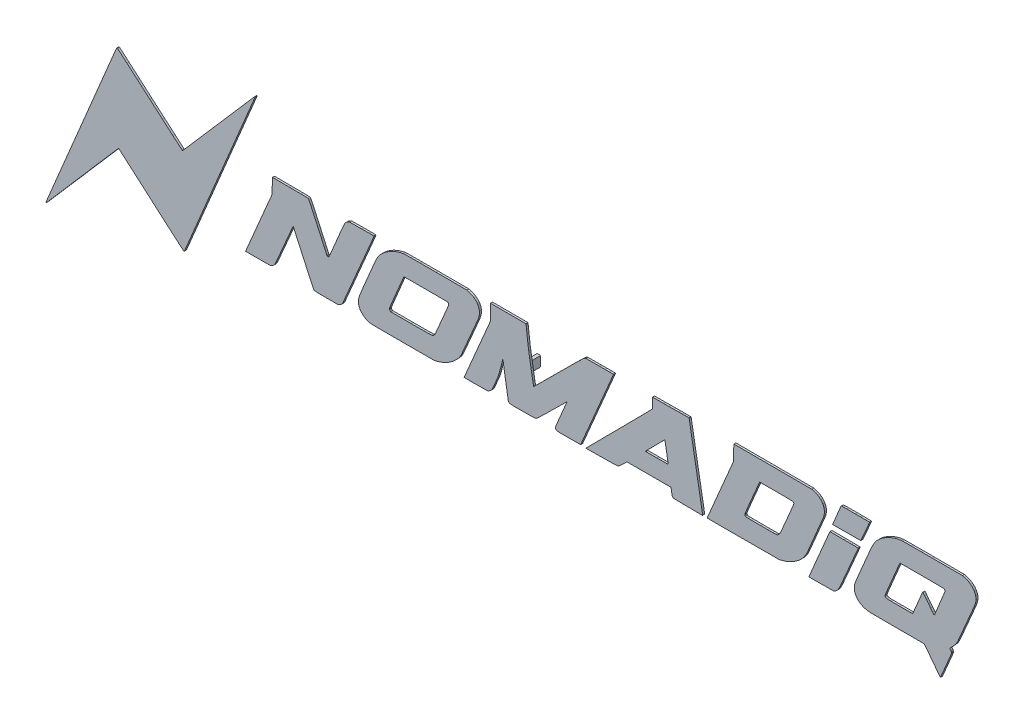
from build123d import *

# Parameters (mm, degrees)
Y_KSEKLIK_EKSTR_ZYON1_DEPTH   = 0.2
Y_KSEKLIK_EKSTR_ZYON1_2_DEPTH = 0.2
Y_KSEKLIK_EKSTR_ZYON1_3_DEPTH = 0.2
Y_KSEKLIK_EKSTR_ZYON1_4_DEPTH = 0.2
Y_KSEKLIK_EKSTR_ZYON1_5_DEPTH = 0.2
Y_KSEKLIK_EKSTR_ZYON1_6_DEPTH = 0.2
Y_KSEKLIK_EKSTR_ZYON1_7_DEPTH = 0.2
Y_KSEKLIK_EKSTR_ZYON1_8_DEPTH = 0.2
Y_KSEKLIK_EKSTR_ZYON1_9_DEPTH = 0.2
SKETCH4_W                     = 0.347706158
SKETCH4_H                     = 0.98459693
BOSS_EXTRUDE2_DEPTH           = 1
SCALE1_SCALE                  = 1.1


with BuildPart() as part:
    # Çizim1 → Yükseklik-Ekstrüzyon1 (new body)
    with BuildSketch(Plane.XY):
        with BuildLine():
            Line((-30.51702252, 5.640207004), (-31.881612062, 4.06777004))
            Line((-31.881612062, 4.06777004), (-33.036250842, 2.743929182))
            Line((-33.036250842, 2.743929182), (-34.080710724, 1.55031139))
            ThreePointArc((-34.080710724, 1.55031139), (-34.091671992, 1.542168784), (-34.10501822, 1.539282674))
            ThreePointArc((-34.10501822, 1.539282674), (-34.118726717, 1.541740246), (-34.130727781, 1.54880686))
            Line((-34.130727781, 1.54880686), (-35.069522655, 2.355004396))
            Line((-35.069522655, 2.355004396), (-36.109605746, 3.251459149))
            Line((-36.109605746, 3.251459149), (-37.338076284, 4.316207648))
            Line((-37.338076284, 4.316207648), (-38.566568336, 5.381941386))
            Line((-38.566568336, 5.381941386), (-39.606822395, 6.281527372))
            Line((-39.606822395, 6.281527372), (-40.544864829, 7.091037097))
            ThreePointArc((-40.544864829, 7.091037097), (-40.557629792, 7.100257414), (-40.571789719, 7.10714617))
            ThreePointArc((-40.571789719, 7.10714617), (-40.5829683, 7.1080489), (-40.592857954, 7.102760201))
            ThreePointArc((-40.592857954, 7.102760201), (-40.60694744, 7.08733319), (-40.619299402, 7.070482809))
            ThreePointArc((-40.619299402, 7.070482809), (-40.636141797, 7.042669784), (-40.651039165, 7.013768244))
            Line((-40.651039165, 7.013768244), (-40.690212238, 6.925912289))
            Line((-40.690212238, 6.925912289), (-42.278492498, 3.135697829))
            Line((-42.278492498, 3.135697829), (-44.770546021, -2.819218747))
            Line((-44.770546021, -2.819218747), (-47.603447582, -9.590605835))
            ThreePointArc((-47.603447582, -9.590605835), (-47.612762095, -9.614842221), (-47.620640209, -9.639582833))
            ThreePointArc((-47.620640209, -9.639582833), (-47.622682953, -9.648464643), (-47.623776393, -9.657512502))
            ThreePointArc((-47.623776393, -9.657512502), (-47.623612418, -9.665158958), (-47.622099978, -9.672656138))
            ThreePointArc((-47.622099978, -9.672656138), (-47.619722824, -9.678038864), (-47.616060206, -9.682644277))
            ThreePointArc((-47.616060206, -9.682644277), (-47.611784824, -9.685434425), (-47.606774081, -9.686412311))
            ThreePointArc((-47.606774081, -9.686412311), (-47.596603781, -9.684206995), (-47.588260373, -9.67798719))
            Line((-47.588260373, -9.67798719), (-46.540995922, -8.475870292))
            Line((-46.540995922, -8.475870292), (-45.384897882, -7.145566779))
            Line((-45.384897882, -7.145566779), (-44.016900278, -5.565418205))
            Line((-44.016900278, -5.565418205), (-42.649292697, -3.985259408))
            Line((-42.649292697, -3.985259408), (-41.494434005, -2.654966117))
            Line((-41.494434005, -2.654966117), (-40.447338079, -1.451149909))
            ThreePointArc((-40.447338079, -1.451149909), (-40.440685567, -1.446184753), (-40.432573306, -1.444424098))
            ThreePointArc((-40.432573306, -1.444424098), (-40.424232802, -1.445927767), (-40.416942521, -1.450249436))
            Line((-40.416942521, -1.450249436), (-39.470783162, -2.269237563))
            Line((-39.470783162, -2.269237563), (-38.425880059, -3.175657308))
            Line((-38.425880059, -3.175657308), (-37.188912139, -4.252299692))
            Line((-37.188912139, -4.252299692), (-35.600632388, -5.633848971))
            Line((-35.600632388, -5.633848971), (-34.660662613, -6.443124897))
            Line((-34.660662613, -6.443124897), (-33.971740802, -7.030480392))
            ThreePointArc((-33.971740802, -7.030480392), (-33.954050802, -7.036456708), (-33.937103258, -7.028618774))
            ThreePointArc((-33.937103258, -7.028618774), (-33.918071544, -7.004488567), (-33.903683781, -6.977332255))
            Line((-33.903683781, -6.977332255), (-30.415719601, 1.344084322))
            Line((-30.415719601, 1.344084322), (-26.926800707, 9.667966428))
            ThreePointArc((-26.926800707, 9.667966428), (-26.918578965, 9.694765841), (-26.915802041, 9.722660181))
            ThreePointArc((-26.915802041, 9.722660181), (-26.916283105, 9.726306898), (-26.91769339, 9.729704111))
            ThreePointArc((-26.91769339, 9.729704111), (-26.920050789, 9.732972259), (-26.923011854, 9.735705429))
            ThreePointArc((-26.923011854, 9.735705429), (-26.926812118, 9.738074074), (-26.930967674, 9.739742558))
            ThreePointArc((-26.930967674, 9.739742558), (-26.935605763, 9.740782255), (-26.94034612, 9.741131333))
            ThreePointArc((-26.94034612, 9.741131333), (-26.949504077, 9.739146935), (-26.957019216, 9.733549729))
            Line((-26.957019216, 9.733549729), (-28.001119252, 8.536484825))
            Line((-28.001119252, 8.536484825), (-29.153229053, 7.212664813))
            ThreePointArc((-29.153229053, 7.212664813), (-29.83537738, 6.426654115), (-30.51702252, 5.640207004))
        make_face()
    extrude(amount=Y_KSEKLIK_EKSTR_ZYON1_DEPTH)


with BuildPart() as body_2:
    # Çizim1 → Y_kseklik-Ekstr_zyon1 2 (new body)
    with BuildSketch(Plane.XY):
        with BuildLine():
            Line((34.002103981, 1.26593393), (33.401469652, -0.133194787))
            Line((33.401469652, -0.133194787), (33.068356265, -0.919046179))
            Line((33.068356265, -0.919046179), (32.780541835, -1.607236246))
            Line((32.780541835, -1.607236246), (32.536345399, -2.197879118))
            ThreePointArc((32.536345399, -2.197879118), (32.514730918, -2.255375588), (32.496752038, -2.314110499))
            ThreePointArc((32.496752038, -2.314110499), (32.475048302, -2.409792708), (32.46158888, -2.506978001))
            ThreePointArc((32.46158888, -2.506978001), (32.454335387, -2.617789021), (32.453635549, -2.728834983))
            ThreePointArc((32.453635549, -2.728834983), (32.45934273, -2.836087206), (32.471456413, -2.942805855))
            ThreePointArc((32.471456413, -2.942805855), (32.488615064, -3.027655366), (32.51524417, -3.110024958))
            ThreePointArc((32.51524417, -3.110024958), (32.598015349, -3.282399035), (32.706692791, -3.439730229))
            ThreePointArc((32.706692791, -3.439730229), (32.842536088, -3.584713762), (32.997270695, -3.709336501))
            ThreePointArc((32.997270695, -3.709336501), (33.178362317, -3.818649104), (33.37209352, -3.903570487))
            ThreePointArc((33.37209352, -3.903570487), (33.588460467, -3.96929215), (33.810587122, -4.011644735))
            ThreePointArc((33.810587122, -4.011644735), (33.899556978, -4.020972591), (33.988931573, -4.024823021))
            Line((33.988931573, -4.024823021), (34.653961876, -4.033038109))
            Line((34.653961876, -4.033038109), (35.528034198, -4.038897814))
            Line((35.528034198, -4.038897814), (36.700634893, -4.040997916))
            Line((36.700634893, -4.040997916), (39.381358713, -4.041881013))
            Line((39.381358713, -4.041881013), (40.168688525, -5.072515387))
            Line((40.168688525, -5.072515387), (40.471672307, -5.468355282))
            Line((40.471672307, -5.468355282), (40.729308349, -5.803224159))
            Line((40.729308349, -5.803224159), (40.960764599, -6.103025222))
            ThreePointArc((40.960764599, -6.103025222), (40.965728178, -6.108380079), (40.971569444, -6.112760857))
            ThreePointArc((40.971569444, -6.112760857), (40.980536493, -6.113867821), (40.987216734, -6.107784423))
            Line((40.987216734, -6.107784423), (41.525271591, -4.840033091))
            Line((41.525271591, -4.840033091), (42.037991789, -3.629832767))
            ThreePointArc((42.037991789, -3.629832767), (42.066806791, -3.554217315), (42.090091671, -3.476720121))
            ThreePointArc((42.090091671, -3.476720121), (42.091866692, -3.462041134), (42.089649173, -3.447422448))
            ThreePointArc((42.089649173, -3.447422448), (42.082221169, -3.425230658), (42.073172234, -3.403649008))
            ThreePointArc((42.073172234, -3.403649008), (42.059673501, -3.37676729), (42.044517758, -3.350783718))
            ThreePointArc((42.044517758, -3.350783718), (42.024882825, -3.320672342), (42.004149576, -3.291306409))
            Line((42.004149576, -3.291306409), (41.905031553, -3.15628061))
            Line((41.905031553, -3.15628061), (42.181877984, -2.866363537))
            ThreePointArc((42.181877984, -2.866363537), (42.242781131, -2.801216626), (42.302290033, -2.734793709))
            ThreePointArc((42.302290033, -2.734793709), (42.360432004, -2.667065558), (42.417129509, -2.598123669))
            ThreePointArc((42.417129509, -2.598123669), (42.467223313, -2.534442912), (42.515886055, -2.469662007))
            ThreePointArc((42.515886055, -2.469662007), (42.552003637, -2.417967566), (42.585675224, -2.364647597))
            ThreePointArc((42.585675224, -2.364647597), (42.664459092, -2.222753419), (42.733677151, -2.075955204))
            Line((42.733677151, -2.075955204), (43.510626934, -0.275958767))
            Line((43.510626934, -0.275958767), (44.264704846, 1.481742999))
            ThreePointArc((44.264704846, 1.481742999), (44.350931551, 1.69607884), (44.42787815, 1.913918501))
            ThreePointArc((44.42787815, 1.913918501), (44.474668475, 2.09316749), (44.498658632, 2.276862908))
            ThreePointArc((44.498658632, 2.276862908), (44.497009246, 2.450071361), (44.468931065, 2.620996797))
            ThreePointArc((44.468931065, 2.620996797), (44.4148335, 2.786765265), (44.33626524, 2.942434016))
            ThreePointArc((44.33626524, 2.942434016), (44.229301586, 3.097540689), (44.104447039, 3.238645774))
            ThreePointArc((44.104447039, 3.238645774), (44.029864114, 3.308427548), (43.950719161, 3.372989031))
            ThreePointArc((43.950719161, 3.372989031), (43.869333945, 3.430315276), (43.783968138, 3.481525928))
            ThreePointArc((43.783968138, 3.481525928), (43.689784399, 3.529322011), (43.592564606, 3.570593723))
            ThreePointArc((43.592564606, 3.570593723), (43.479323979, 3.611196818), (43.364327949, 3.646523356))
            Line((43.364327949, 3.646523356), (43.154477618, 3.705717052))
            Line((43.154477618, 3.705717052), (40.210910399, 3.709983164))
            Line((40.210910399, 3.709983164), (39.068321673, 3.709918807))
            Line((39.068321673, 3.709918807), (38.073061083, 3.706102713))
            Line((38.073061083, 3.706102713), (37.218259588, 3.700145881))
            ThreePointArc((37.218259588, 3.700145881), (37.142324383, 3.697538292), (37.066645419, 3.690781867))
            ThreePointArc((37.066645419, 3.690781867), (36.748045846, 3.637240098), (36.436400062, 3.552097196))
            ThreePointArc((36.436400062, 3.552097196), (36.105836544, 3.429413364), (35.785714306, 3.281611761))
            ThreePointArc((35.785714306, 3.281611761), (35.477485507, 3.109336623), (35.183436904, 2.913839475))
            ThreePointArc((35.183436904, 2.913839475), (34.930019667, 2.711059171), (34.69791904, 2.484190383))
            ThreePointArc((34.69791904, 2.484190383), (34.579233333, 2.345083525), (34.472303979, 2.19674901))
            ThreePointArc((34.472303979, 2.19674901), (34.366932693, 2.025944773), (34.272331054, 1.848948374))
            ThreePointArc((34.272331054, 1.848948374), (34.133445435, 1.559189511), (34.002103981, 1.26593393))
        make_face()
        with BuildLine():
            Line((41.408932632, 1.420979396), (40.91452838, 0.216535294))
            Line((40.91452838, 0.216535294), (40.420055007, -0.983846467))
            ThreePointArc((40.420055007, -0.983846467), (40.394632125, -1.032636029), (40.36097483, -1.076155344))
            ThreePointArc((40.36097483, -1.076155344), (40.353893848, -1.079121384), (40.347004716, -1.075733531))
            Line((40.347004716, -1.075733531), (40.188024724, -0.881888373))
            Line((40.188024724, -0.881888373), (40.008118257, -0.657479184))
            Line((40.008118257, -0.657479184), (39.797898801, -0.387093027))
            Line((39.797898801, -0.387093027), (39.587724356, -0.115332545))
            Line((39.587724356, -0.115332545), (39.407830653, 0.113502565))
            Line((39.407830653, 0.113502565), (39.246786084, 0.316042494))
            ThreePointArc((39.246786084, 0.316042494), (39.241550776, 0.320222793), (39.235019549, 0.321714909))
            ThreePointArc((39.235019549, 0.321714909), (39.228900127, 0.31988751), (39.224784801, 0.315003783))
            Line((39.224784801, 0.315003783), (39.077385422, -0.02410947))
            Line((39.077385422, -0.02410947), (38.914183191, -0.404157207))
            Line((38.914183191, -0.404157207), (38.723806616, -0.855559582))
            Line((38.723806616, -0.855559582), (38.230691459, -2.0328341))
            Line((38.230691459, -2.0328341), (36.946225763, -2.032592005))
            Line((36.946225763, -2.032592005), (36.026738721, -2.029967306))
            ThreePointArc((36.026738721, -2.029967306), (35.875481064, -2.025703145), (35.724571992, -2.014589469))
            ThreePointArc((35.724571992, -2.014589469), (35.649544634, -2.000929952), (35.577853042, -1.974929904))
            ThreePointArc((35.577853042, -1.974929904), (35.532477481, -1.941704962), (35.503641511, -1.893421163))
            ThreePointArc((35.503641511, -1.893421163), (35.495867211, -1.846409501), (35.504617437, -1.79956967))
            ThreePointArc((35.504617437, -1.79956967), (35.569300493, -1.630500251), (35.636155399, -1.462277817))
            Line((35.636155399, -1.462277817), (35.891488635, -0.845567436))
            Line((35.891488635, -0.845567436), (36.712056433, 1.091061579))
            Line((36.712056433, 1.091061579), (36.964632723, 1.686464948))
            Line((36.964632723, 1.686464948), (39.137080729, 1.686464948))
            Line((39.137080729, 1.686464948), (40.393285557, 1.685244626))
            Line((40.393285557, 1.685244626), (40.954397599, 1.679463593))
            Line((40.954397599, 1.679463593), (41.291963335, 1.67025887))
            ThreePointArc((41.291963335, 1.67025887), (41.332353577, 1.663192525), (41.369002218, 1.644802802))
            ThreePointArc((41.369002218, 1.644802802), (41.382729515, 1.633866704), (41.39500652, 1.621324294))
            ThreePointArc((41.39500652, 1.621324294), (41.405282108, 1.607693996), (41.413643556, 1.592812501))
            ThreePointArc((41.413643556, 1.592812501), (41.420269677, 1.576286022), (41.4247472, 1.559052862))
            ThreePointArc((41.4247472, 1.559052862), (41.427541535, 1.539642723), (41.428475816, 1.520054744))
            ThreePointArc((41.428475816, 1.520054744), (41.423543396, 1.469562516), (41.408932632, 1.420979396))
        make_face(mode=Mode.SUBTRACT)
    extrude(amount=Y_KSEKLIK_EKSTR_ZYON1_2_DEPTH)


with BuildPart() as body_3:
    # Çizim1 → Y_kseklik-Ekstr_zyon1 3 (new body)
    with BuildSketch(Plane.XY):
        with BuildLine():
            Line((-25.211224785, 2.950808873), (-25.227873842, 2.206347809))
            Line((-25.227873842, 2.206347809), (-26.529654081, -0.856672391))
            Line((-26.529654081, -0.856672391), (-27.029758258, -2.03354637))
            Line((-27.029758258, -2.03354637), (-27.453071642, -3.030058673))
            Line((-27.453071642, -3.030058673), (-27.833703249, -3.926302131))
            Line((-27.833703249, -3.926302131), (-27.845171441, -3.954171772))
            ThreePointArc((-27.845171441, -3.954171772), (-27.843842865, -3.967312442), (-27.83231739, -3.973762693))
            Line((-27.83231739, -3.973762693), (-27.614904594, -3.980356068))
            Line((-27.614904594, -3.980356068), (-27.278222587, -3.983689979))
            Line((-27.278222587, -3.983689979), (-26.631394189, -3.980931963))
            Line((-26.631394189, -3.980931963), (-25.403879775, -3.973212512))
            Line((-25.403879775, -3.973212512), (-25.250700632, -3.897992354))
            ThreePointArc((-25.250700632, -3.897992354), (-25.217687603, -3.880680333), (-25.185638296, -3.861643313))
            ThreePointArc((-25.185638296, -3.861643313), (-25.150757396, -3.838720203), (-25.11676827, -3.814494484))
            ThreePointArc((-25.11676827, -3.814494484), (-25.085085464, -3.790041552), (-25.054363066, -3.764392375))
            ThreePointArc((-25.054363066, -3.764392375), (-25.031252928, -3.742732785), (-25.009863314, -3.719372548))
            ThreePointArc((-25.009863314, -3.719372548), (-24.972694312, -3.668803102), (-24.942874437, -3.613580113))
            Line((-24.942874437, -3.613580113), (-24.735598075, -3.156531823))
            Line((-24.735598075, -3.156531823), (-24.453957617, -2.517394056))
            Line((-24.453957617, -2.517394056), (-24.039131152, -1.554161376))
            Line((-24.039131152, -1.554161376), (-23.699391394, -0.763531183))
            Line((-23.699391394, -0.763531183), (-23.410821404, -0.09780246))
            Line((-23.410821404, -0.09780246), (-23.149294716, 0.502140639))
            ThreePointArc((-23.149294716, 0.502140639), (-23.145665955, 0.506536134), (-23.140260373, 0.508343886))
            ThreePointArc((-23.140260373, 0.508343886), (-23.134825907, 0.506946553), (-23.131091279, 0.502758652))
            Line((-23.131091279, 0.502758652), (-22.835810828, -0.136341435))
            Line((-22.835810828, -0.136341435), (-22.51000193, -0.845183811))
            Line((-22.51000193, -0.845183811), (-22.126024477, -1.687301169))
            Line((-22.126024477, -1.687301169), (-21.620113231, -2.795615239))
            Line((-21.620113231, -2.795615239), (-21.322786771, -3.432082174))
            Line((-21.322786771, -3.432082174), (-21.11385138, -3.866353122))
            ThreePointArc((-21.11385138, -3.866353122), (-21.090737802, -3.90108777), (-21.059220458, -3.928426211))
            ThreePointArc((-21.059220458, -3.928426211), (-21.023863025, -3.945901297), (-20.985349445, -3.954400168))
            ThreePointArc((-20.985349445, -3.954400168), (-20.899319004, -3.961416502), (-20.813117741, -3.965867101))
            ThreePointArc((-20.813117741, -3.965867101), (-20.663197966, -3.970135482), (-20.513228263, -3.971937272))
            Line((-20.513228263, -3.971937272), (-19.839021238, -3.973214245))
            Line((-19.839021238, -3.973214245), (-18.687190754, -3.973214245))
            Line((-18.687190754, -3.973214245), (-18.517445616, -3.881186024))
            ThreePointArc((-18.517445616, -3.881186024), (-18.482303458, -3.861238906), (-18.44796421, -3.839939262))
            ThreePointArc((-18.44796421, -3.839939262), (-18.41333894, -3.816639004), (-18.379558411, -3.792130084))
            ThreePointArc((-18.379558411, -3.792130084), (-18.350067102, -3.769084074), (-18.32142443, -3.744991477))
            ThreePointArc((-18.32142443, -3.744991477), (-18.302919485, -3.727044384), (-18.286407888, -3.707247961))
            ThreePointArc((-18.286407888, -3.707247961), (-18.252048136, -3.65510512), (-18.224151108, -3.599237201))
            Line((-18.224151108, -3.599237201), (-16.713731049, -0.059918911))
            Line((-16.713731049, -0.059918911), (-15.222493404, 3.436166873))
            ThreePointArc((-15.222493404, 3.436166873), (-15.181801611, 3.540930402), (-15.148018691, 3.648121508))
            ThreePointArc((-15.148018691, 3.648121508), (-15.151158888, 3.667669436), (-15.168063421, 3.677975702))
            ThreePointArc((-15.168063421, 3.677975702), (-15.238167294, 3.684653858), (-15.308486134, 3.688450118))
            ThreePointArc((-15.308486134, 3.688450118), (-15.449595441, 3.691794732), (-15.590743095, 3.692397122))
            Line((-15.590743095, 3.692397122), (-16.348890724, 3.688267249))
            Line((-16.348890724, 3.688267249), (-17.563283304, 3.680066712))
            Line((-17.563283304, 3.680066712), (-17.695506951, 3.614506057))
            ThreePointArc((-17.695506951, 3.614506057), (-17.802334593, 3.550033382), (-17.89708974, 3.468852518))
            ThreePointArc((-17.89708974, 3.468852518), (-17.981687679, 3.369816632), (-18.051028752, 3.259559055))
            ThreePointArc((-18.051028752, 3.259559055), (-18.153011486, 3.057283908), (-18.246144045, 2.850784419))
            Line((-18.246144045, 2.850784419), (-18.805874805, 1.52590103))
            Line((-18.805874805, 1.52590103), (-19.098449411, 0.831007738))
            Line((-19.098449411, 0.831007738), (-19.349111607, 0.240390047))
            Line((-19.349111607, 0.240390047), (-19.573236314, -0.284773761))
            ThreePointArc((-19.573236314, -0.284773761), (-19.580906662, -0.299875069), (-19.590508016, -0.313828482))
            ThreePointArc((-19.590508016, -0.313828482), (-19.597563454, -0.321059745), (-19.605960459, -0.326677634))
            ThreePointArc((-19.605960459, -0.326677634), (-19.618425121, -0.33259943), (-19.631343535, -0.337452268))
            ThreePointArc((-19.631343535, -0.337452268), (-19.646310856, -0.34172327), (-19.661567254, -0.344806209))
            ThreePointArc((-19.661567254, -0.344806209), (-19.676924497, -0.346659137), (-19.692380729, -0.347278109))
            ThreePointArc((-19.692380729, -0.347278109), (-19.707631947, -0.346658834), (-19.722782748, -0.344805085))
            ThreePointArc((-19.722782748, -0.344805085), (-19.737441352, -0.341752399), (-19.751783682, -0.337452268))
            ThreePointArc((-19.751783682, -0.337452268), (-19.763833164, -0.332620652), (-19.775375089, -0.326677715))
            ThreePointArc((-19.775375089, -0.326677715), (-19.782823658, -0.321072837), (-19.788690101, -0.313828482))
            ThreePointArc((-19.788690101, -0.313828482), (-19.796630266, -0.300140237), (-19.803663618, -0.285964687))
            Line((-19.803663618, -0.285964687), (-20.059785204, 0.275398962))
            Line((-20.059785204, 0.275398962), (-20.346168765, 0.904480674))
            Line((-20.346168765, 0.904480674), (-20.682237627, 1.645080393))
            Line((-20.682237627, 1.645080393), (-21.125146527, 2.61767739))
            Line((-21.125146527, 2.61767739), (-21.387348416, 3.17841972))
            Line((-21.387348416, 3.17841972), (-21.570183946, 3.555457177))
            ThreePointArc((-21.570183946, 3.555457177), (-21.595062868, 3.593817601), (-21.628220762, 3.62529834))
            ThreePointArc((-21.628220762, 3.62529834), (-21.66998415, 3.648475335), (-21.716412578, 3.659689374))
            ThreePointArc((-21.716412578, 3.659689374), (-21.819651831, 3.668505866), (-21.923130902, 3.673812074))
            ThreePointArc((-21.923130902, 3.673812074), (-22.124276987, 3.679245381), (-22.325480701, 3.681762169))
            Line((-22.325480701, 3.681762169), (-23.448059115, 3.687666328))
            Line((-23.448059115, 3.687666328), (-25.194575701, 3.69526991))
            Line((-25.194575701, 3.69526991), (-25.211224785, 2.950808873))
        make_face()
    extrude(amount=Y_KSEKLIK_EKSTR_ZYON1_3_DEPTH)


with BuildPart() as body_4:
    # Çizim1 → Y_kseklik-Ekstr_zyon1 4 (new body)
    with BuildSketch(Plane.XY):
        with BuildLine():
            Line((-3.581342788, 2.937687788), (-3.581342788, 2.181933006))
            Line((-3.581342788, 2.181933006), (-4.877979733, -0.855499969))
            Line((-4.877979733, -0.855499969), (-5.376389886, -2.023485284))
            Line((-5.376389886, -2.023485284), (-5.798977842, -3.01476082))
            Line((-5.798977842, -3.01476082), (-6.177187776, -3.902529936))
            Line((-6.177187776, -3.902529936), (-6.192483113, -3.940843862))
            ThreePointArc((-6.192483113, -3.940843862), (-6.19070565, -3.959778104), (-6.174757915, -3.97013835))
            ThreePointArc((-6.174757915, -3.97013835), (-6.108607024, -3.976973725), (-6.042214703, -3.980810708))
            ThreePointArc((-6.042214703, -3.980810708), (-5.907118341, -3.984188986), (-5.771981293, -3.984835491))
            Line((-5.771981293, -3.984835491), (-5.049714422, -3.980989702))
            Line((-5.049714422, -3.980989702), (-3.889079328, -3.97321831))
            Line((-3.889079328, -3.97321831), (-3.755280818, -3.902422923))
            ThreePointArc((-3.755280818, -3.902422923), (-3.699406401, -3.871110537), (-3.645107405, -3.837139446))
            ThreePointArc((-3.645107405, -3.837139446), (-3.599819747, -3.804816928), (-3.557023912, -3.769260866))
            ThreePointArc((-3.557023912, -3.769260866), (-3.521239651, -3.734453546), (-3.488472326, -3.696792355))
            ThreePointArc((-3.488472326, -3.696792355), (-3.460868421, -3.65854243), (-3.437163193, -3.617761375))
            Line((-3.437163193, -3.617761375), (-3.409467918, -3.559967109))
            Line((-3.409467918, -3.559967109), (-3.318231303, -3.353000723))
            Line((-3.318231303, -3.353000723), (-3.210920349, -3.107231993))
            Line((-3.210920349, -3.107231993), (-3.091713476, -2.831363443))
            Line((-3.091713476, -2.831363443), (-2.901984085, -2.380888318))
            ThreePointArc((-2.901984085, -2.380888318), (-2.849132695, -2.246303299), (-2.800821012, -2.110022788))
            ThreePointArc((-2.800821012, -2.110022788), (-2.75541317, -1.967498293), (-2.714442326, -1.823635533))
            Line((-2.714442326, -1.823635533), (-2.576637461, -1.297248111))
            Line((-2.576637461, -1.297248111), (-2.364693476, -0.46769735))
            Line((-2.364693476, -0.46769735), (-2.342424293, -0.614875711))
            Line((-2.342424293, -0.614875711), (-2.175886465, -1.688377522))
            Line((-2.175886465, -1.688377522), (-2.001020215, -2.762609366))
            Line((-2.001020215, -2.762609366), (-1.827657004, -3.799629649))
            ThreePointArc((-1.827657004, -3.799629649), (-1.817395198, -3.837107712), (-1.799818726, -3.871762834))
            ThreePointArc((-1.799818726, -3.871762834), (-1.760431233, -3.913931089), (-1.708668946, -3.939430146))
            ThreePointArc((-1.708668946, -3.939430146), (-1.619855191, -3.95992499), (-1.52943784, -3.971441252))
            ThreePointArc((-1.52943784, -3.971441252), (-1.361958109, -3.981086279), (-1.194232166, -3.984325861))
            Line((-1.194232166, -3.984325861), (-0.370178516, -3.981533674))
            Line((-0.370178516, -3.981533674), (0.412079155, -3.974955416))
            ThreePointArc((0.412079155, -3.974955416), (0.547774653, -3.97215356), (0.683377872, -3.966418964))
            ThreePointArc((0.683377872, -3.966418964), (0.758299272, -3.959984356), (0.832642232, -3.948681938))
            ThreePointArc((0.832642232, -3.948681938), (0.888170338, -3.934183881), (0.941046882, -3.911876136))
            ThreePointArc((0.941046882, -3.911876136), (0.992500522, -3.880863438), (1.03902599, -3.842854948))
            Line((1.03902599, -3.842854948), (1.389463403, -3.51226382))
            Line((1.389463403, -3.51226382), (1.858226268, -3.059906204))
            Line((1.858226268, -3.059906204), (2.519872102, -2.409282638))
            Line((2.519872102, -2.409282638), (3.079518863, -1.857025568))
            Line((3.079518863, -1.857025568), (3.55159268, -1.39300024))
            Line((3.55159268, -1.39300024), (3.979388074, -0.973548682))
            ThreePointArc((3.979388074, -0.973548682), (3.981752203, -0.972565078), (3.984141133, -0.973486813))
            ThreePointArc((3.984141133, -0.973486813), (3.985534003, -0.975937947), (3.985273983, -0.978745176))
            Line((3.985273983, -0.978745176), (3.822937263, -1.366031839))
            Line((3.822937263, -1.366031839), (3.64253716, -1.794380169))
            Line((3.64253716, -1.794380169), (3.427125626, -2.30214522))
            Line((3.427125626, -2.30214522), (3.210345334, -2.815298578))
            Line((3.210345334, -2.815298578), (3.02532177, -3.261124231))
            Line((3.02532177, -3.261124231), (2.867303964, -3.647433203))
            ThreePointArc((2.867303964, -3.647433203), (2.856866474, -3.677566958), (2.849710985, -3.708644014))
            ThreePointArc((2.849710985, -3.708644014), (2.845973777, -3.745525407), (2.847549657, -3.782562152))
            ThreePointArc((2.847549657, -3.782562152), (2.854536895, -3.815872144), (2.867531368, -3.847328792))
            ThreePointArc((2.867531368, -3.847328792), (2.886447157, -3.876601018), (2.910271107, -3.902038976))
            ThreePointArc((2.910271107, -3.902038976), (2.941141306, -3.926286718), (2.97480815, -3.946472498))
            ThreePointArc((2.97480815, -3.946472498), (3.013686618, -3.961838711), (3.054855409, -3.969104141))
            ThreePointArc((3.054855409, -3.969104141), (3.149011305, -3.974975016), (3.243277696, -3.978669236))
            ThreePointArc((3.243277696, -3.978669236), (3.400427041, -3.981853612), (3.557606227, -3.982725472))
            Line((3.557606227, -3.982725472), (4.195740639, -3.980199115))
            Line((4.195740639, -3.980199115), (5.337959412, -3.973221282))
            Line((5.337959412, -3.973221282), (6.966141947, -0.151542952))
            Line((6.966141947, -0.151542952), (7.590452564, 1.31477638))
            Line((7.590452564, 1.31477638), (8.116045838, 2.551335091))
            Line((8.116045838, 2.551335091), (8.592238508, 3.672881405))
            ThreePointArc((8.592238508, 3.672881405), (8.593797679, 3.677901592), (8.594324454, 3.68313187))
            ThreePointArc((8.594324454, 3.68313187), (8.592776351, 3.686879381), (8.58903474, 3.688441694))
            Line((8.58903474, 3.688441694), (8.19146549, 3.68994968))
            Line((8.19146549, 3.68994968), (7.748767457, 3.690239006))
            Line((7.748767457, 3.690239006), (7.222889727, 3.688090951))
            Line((7.222889727, 3.688090951), (5.851455, 3.680053487))
            Line((5.851455, 3.680053487), (5.71765649, 3.615824288))
            ThreePointArc((5.71765649, 3.615824288), (5.650411941, 3.576670019), (5.590236811, 3.527336057))
            Line((5.590236811, 3.527336057), (5.118193952, 3.072857184))
            Line((5.118193952, 3.072857184), (4.407638634, 2.374674269))
            Line((4.407638634, 2.374674269), (3.128651934, 1.100755241))
            Line((3.128651934, 1.100755241), (2.187151745, 0.162855195))
            Line((2.187151745, 0.162855195), (1.394665044, -0.622263838))
            Line((1.394665044, -0.622263838), (0.681246947, -1.326491717))
            ThreePointArc((0.681246947, -1.326491717), (0.676262866, -1.327457611), (0.673449277, -1.32323177))
            ThreePointArc((0.673449277, -1.32323177), (0.67299094, -1.312469272), (0.67161927, -1.301784706))
            Line((0.67161927, -1.301784706), (0.598422887, -0.875986487))
            Line((0.598422887, -0.875986487), (0.515960564, -0.399306737))
            Line((0.515960564, -0.399306737), (0.418040258, 0.161592244))
            Line((0.418040258, 0.161592244), (0.291188032, 0.903058978))
            Line((0.291188032, 0.903058978), (0.196068557, 1.500503631))
            Line((0.196068557, 1.500503631), (0.121258385, 2.026138864))
            Line((0.121258385, 2.026138864), (0.057410592, 2.542769672))
            Line((0.057410592, 2.542769672), (0.015963453, 2.90471522))
            Line((0.015963453, 2.90471522), (-0.021497427, 3.228194365))
            Line((-0.021497427, 3.228194365), (-0.053395607, 3.500805617))
            Line((-0.053395607, 3.500805617), (-0.063455837, 3.579708124))
            Line((-0.063455837, 3.579708124), (-0.079101673, 3.693436857))
            Line((-0.079101673, 3.693436857), (-1.830222506, 3.693436857))
            Line((-1.830222506, 3.693436857), (-3.581342788, 3.693436857))
            Line((-3.581342788, 3.693436857), (-3.581342788, 2.937687788))
        make_face()
    extrude(amount=Y_KSEKLIK_EKSTR_ZYON1_4_DEPTH)

    # Sketch4 → Boss-Extrude2 (add)
    with BuildSketch(Plane(origin=(0, 0, 0), x_dir=(-1, 0, 0), z_dir=(0, 0, -1))):
        Rectangle(SKETCH4_W, SKETCH4_H)
    extrude(amount=BOSS_EXTRUDE2_DEPTH)


with BuildPart() as body_5:
    # Çizim1 → Y_kseklik-Ekstr_zyon1 5 (new body)
    with BuildSketch(Plane.XY):
        with BuildLine():
            Line((13.591695964, 3.673380528), (12.447718704, 3.666108284))
            Line((12.447718704, 3.666108284), (12.447718704, 3.155410932))
            Line((12.447718704, 3.155410932), (12.447718704, 2.64471358))
            Line((12.447718704, 2.64471358), (11.972733993, 2.155333862))
            Line((11.972733993, 2.155333862), (11.660281424, 1.836288425))
            Line((11.660281424, 1.836288425), (10.807976166, 0.974355882))
            Line((10.807976166, 0.974355882), (9.790523593, -0.052936313))
            Line((9.790523593, -0.052936313), (8.674600723, -1.17780265))
            Line((8.674600723, -1.17780265), (5.851452163, -4.021559472))
            Line((5.851452163, -4.021559472), (7.400482951, -4.003709787))
            Line((7.400482951, -4.003709787), (8.366956846, -3.991388577))
            ThreePointArc((8.366956846, -3.991388577), (8.555267482, -3.987403622), (8.743501416, -3.980713195))
            ThreePointArc((8.743501416, -3.980713195), (8.847707326, -3.974437186), (8.951630966, -3.964530774))
            ThreePointArc((8.951630966, -3.964530774), (9.012300957, -3.95295854), (9.070519291, -3.932333554))
            ThreePointArc((9.070519291, -3.932333554), (9.108676622, -3.912748433), (9.144323299, -3.888897366))
            ThreePointArc((9.144323299, -3.888897366), (9.198666305, -3.846504519), (9.251707467, -3.802493714))
            ThreePointArc((9.251707467, -3.802493714), (9.320097967, -3.74248067), (9.386959109, -3.680768325))
            Line((9.386959109, -3.680768325), (9.554919536, -3.517924085))
            Line((9.554919536, -3.517924085), (9.918314229, -3.157041112))
            Line((9.918314229, -3.157041112), (12.103479168, -3.157041112))
            Line((12.103479168, -3.157041112), (14.288644106, -3.157041112))
            Line((14.288644106, -3.157041112), (14.319315836, -3.3376691))
            Line((14.319315836, -3.3376691), (14.333123494, -3.419007141))
            Line((14.333123494, -3.419007141), (14.34933099, -3.514526888))
            Line((14.34933099, -3.514526888), (14.365325959, -3.608828211))
            Line((14.365325959, -3.608828211), (14.378424191, -3.686090321))
            ThreePointArc((14.378424191, -3.686090321), (14.38496437, -3.720539801), (14.39285899, -3.754704338))
            ThreePointArc((14.39285899, -3.754704338), (14.402111767, -3.788606903), (14.412686511, -3.822120671))
            ThreePointArc((14.412686511, -3.822120671), (14.423089822, -3.851055711), (14.434635942, -3.879554002))
            ThreePointArc((14.434635942, -3.879554002), (14.443710759, -3.897257414), (14.455129511, -3.913547754))
            Line((14.455129511, -3.913547754), (14.503398208, -3.973212023))
            Line((14.503398208, -3.973212023), (15.951798842, -3.996773806))
            Line((15.951798842, -3.996773806), (16.508385069, -4.004548196))
            Line((16.508385069, -4.004548196), (16.979872152, -4.008273949))
            Line((16.979872152, -4.008273949), (17.400693781, -4.009846857))
            ThreePointArc((17.400693781, -4.009846857), (17.409896429, -4.008040294), (17.417698554, -4.002836519))
            ThreePointArc((17.417698554, -4.002836519), (17.425884203, -3.989352189), (17.426924001, -3.973612086))
            Line((17.426924001, -3.973612086), (16.759811494, -0.174981033))
            Line((16.759811494, -0.174981033), (16.096046881, 3.603415005))
            ThreePointArc((16.096046881, 3.603415005), (16.086078489, 3.639653057), (16.069478939, 3.673372787))
            ThreePointArc((16.069478939, 3.673372787), (16.063459353, 3.679206411), (16.055383791, 3.681454052))
            Line((16.055383791, 3.681454052), (15.866662903, 3.685668583))
            Line((15.866662903, 3.685668583), (15.650595757, 3.688053729))
            Line((15.650595757, 3.688053729), (15.396396571, 3.687047671))
            Line((15.396396571, 3.687047671), (15.064684295, 3.684093534))
            Line((15.064684295, 3.684093534), (14.593717393, 3.680395048))
            Line((14.593717393, 3.680395048), (14.078109662, 3.67663341))
            ThreePointArc((14.078109662, 3.67663341), (13.834903081, 3.67496684), (13.591695964, 3.673380528))
        make_face()
        with BuildLine():
            Line((13.853552226, -0.354999481), (13.915636046, -0.717684158))
            Line((13.915636046, -0.717684158), (13.966243406, -1.026353628))
            Line((13.966243406, -1.026353628), (14.009776357, -1.300406533))
            ThreePointArc((14.009776357, -1.300406533), (14.009759396, -1.309078736), (14.007034075, -1.317311599))
            ThreePointArc((14.007034075, -1.317311599), (13.995308672, -1.329872078), (13.978770455, -1.334534486))
            Line((13.978770455, -1.334534486), (12.888343957, -1.337035454))
            Line((12.888343957, -1.337035454), (11.795917416, -1.338965257))
            ThreePointArc((11.795917416, -1.338965257), (11.783762948, -1.333946919), (11.778726154, -1.321800086))
            ThreePointArc((11.778726154, -1.321800086), (11.78239682, -1.303189638), (11.792858996, -1.287366699))
            Line((11.792858996, -1.287366699), (12.722639693, -0.345511936))
            Line((12.722639693, -0.345511936), (13.656683907, 0.60013871))
            ThreePointArc((13.656683907, 0.60013871), (13.666680675, 0.604332847), (13.676702679, 0.600199374))
            ThreePointArc((13.676702679, 0.600199374), (13.68091864, 0.594476389), (13.683248558, 0.587760858))
            Line((13.683248558, 0.587760858), (13.733996809, 0.314265162))
            Line((13.733996809, 0.314265162), (13.78978383, 0.007183104))
            ThreePointArc((13.78978383, 0.007183104), (13.821854914, -0.173875284), (13.853552226, -0.354999481))
        make_face(mode=Mode.SUBTRACT)
    extrude(amount=Y_KSEKLIK_EKSTR_ZYON1_5_DEPTH)


with BuildPart() as body_6:
    # Çizim1 → Y_kseklik-Ekstr_zyon1 6 (new body)
    with BuildSketch(Plane.XY):
        with BuildLine():
            Line((31.112719083, 3.61013533), (31.010052357, 3.365928946))
            Line((31.010052357, 3.365928946), (30.89190953, 3.083300172))
            Line((30.89190953, 3.083300172), (30.756421065, 2.756853028))
            Line((30.756421065, 2.756853028), (30.618808468, 2.424701518))
            Line((30.618808468, 2.424701518), (30.493966831, 2.124125146))
            Line((30.493966831, 2.124125146), (30.388978057, 1.8719529))
            Line((30.388978057, 1.8719529), (30.352849088, 1.786575589))
            Line((30.352849088, 1.786575589), (30.29813762, 1.659228763))
            Line((30.29813762, 1.659228763), (31.693687253, 1.66615693))
            Line((31.693687253, 1.66615693), (33.089236887, 1.673085097))
            Line((33.089236887, 1.673085097), (33.525372371, 2.663194071))
            Line((33.525372371, 2.663194071), (33.69261818, 3.044235877))
            Line((33.69261818, 3.044235877), (33.833541594, 3.368354017))
            Line((33.833541594, 3.368354017), (33.958614301, 3.657906703))
            ThreePointArc((33.958614301, 3.657906703), (33.961055271, 3.665476821), (33.962013505, 3.673372821))
            ThreePointArc((33.962013505, 3.673372821), (33.95977608, 3.679139125), (33.954103599, 3.681604746))
            Line((33.954103599, 3.681604746), (33.549962424, 3.687547091))
            Line((33.549962424, 3.687547091), (33.096884008, 3.692000414))
            Line((33.096884008, 3.692000414), (32.558576316, 3.693442575))
            Line((32.558576316, 3.693442575), (31.697002862, 3.692336462))
            ThreePointArc((31.697002862, 3.692336462), (31.529332623, 3.690639931), (31.361707114, 3.686411918))
            ThreePointArc((31.361707114, 3.686411918), (31.267942718, 3.682232818), (31.174302699, 3.675847407))
            ThreePointArc((31.174302699, 3.675847407), (31.148374476, 3.666927147), (31.129957551, 3.646613096))
            ThreePointArc((31.129957551, 3.646613096), (31.120941637, 3.628561674), (31.112719083, 3.61013533))
        make_face()
    extrude(amount=Y_KSEKLIK_EKSTR_ZYON1_6_DEPTH)


with BuildPart() as body_7:
    # Çizim1 → Y_kseklik-Ekstr_zyon1 7 (new body)
    with BuildSketch(Plane.XY):
        with BuildLine():
            Line((-14.928138507, 1.758356615), (-15.172333555, 1.188149123))
            Line((-15.172333555, 1.188149123), (-15.455645504, 0.523192953))
            Line((-15.455645504, 0.523192953), (-15.778903293, -0.240233595))
            Line((-15.778903293, -0.240233595), (-16.38384481, -1.682932245))
            ThreePointArc((-16.38384481, -1.682932245), (-16.492546721, -1.956725141), (-16.592156754, -2.233955184))
            ThreePointArc((-16.592156754, -2.233955184), (-16.639880175, -2.398482509), (-16.672244795, -2.566706458))
            ThreePointArc((-16.672244795, -2.566706458), (-16.682347813, -2.712050518), (-16.670749998, -2.857282944))
            ThreePointArc((-16.670749998, -2.857282944), (-16.651609527, -2.957214032), (-16.625523774, -3.055560936))
            ThreePointArc((-16.625523774, -3.055560936), (-16.594736036, -3.142100568), (-16.555875522, -3.225328286))
            ThreePointArc((-16.555875522, -3.225328286), (-16.508129664, -3.30679487), (-16.453136516, -3.383555701))
            ThreePointArc((-16.453136516, -3.383555701), (-16.382832864, -3.467556124), (-16.30770931, -3.54727517))
            ThreePointArc((-16.30770931, -3.54727517), (-16.230933159, -3.619602234), (-16.149948825, -3.687184178))
            ThreePointArc((-16.149948825, -3.687184178), (-16.070215782, -3.745140417), (-15.986434442, -3.797072787))
            ThreePointArc((-15.986434442, -3.797072787), (-15.897666117, -3.843510204), (-15.805780202, -3.883425462))
            ThreePointArc((-15.805780202, -3.883425462), (-15.702052685, -3.920894313), (-15.596448981, -3.952693218))
            ThreePointArc((-15.596448981, -3.952693218), (-15.504170827, -3.972241493), (-15.410274322, -3.981232547))
            ThreePointArc((-15.410274322, -3.981232547), (-15.192441959, -3.988355926), (-14.974538656, -3.992809116))
            Line((-14.974538656, -3.992809116), (-14.201239142, -3.998810487))
            Line((-14.201239142, -3.998810487), (-12.291625786, -3.999971725))
            Line((-12.291625786, -3.999971725), (-9.160740653, -3.999971725))
            Line((-9.160740653, -3.999971725), (-8.872671765, -3.924864653))
            ThreePointArc((-8.872671765, -3.924864653), (-8.606556175, -3.846491173), (-8.345876713, -3.751590552))
            ThreePointArc((-8.345876713, -3.751590552), (-8.098720424, -3.64284155), (-7.859526301, -3.517546907))
            ThreePointArc((-7.859526301, -3.517546907), (-7.631219554, -3.377311845), (-7.413061305, -3.221758568))
            ThreePointArc((-7.413061305, -3.221758568), (-7.20326046, -3.0497456), (-7.005274729, -2.864255693))
            ThreePointArc((-7.005274729, -2.864255693), (-6.943134452, -2.80073685), (-6.882342531, -2.735926358))
            ThreePointArc((-6.882342531, -2.735926358), (-6.823660322, -2.670618883), (-6.766414658, -2.604048606))
            ThreePointArc((-6.766414658, -2.604048606), (-6.716231693, -2.542970211), (-6.667473336, -2.480748649))
            ThreePointArc((-6.667473336, -2.480748649), (-6.631508611, -2.431272847), (-6.598016442, -2.380090906))
            ThreePointArc((-6.598016442, -2.380090906), (-6.518184204, -2.239941857), (-6.448961621, -2.094260093))
            Line((-6.448961621, -2.094260093), (-5.65771842, -0.256093023))
            Line((-5.65771842, -0.256093023), (-4.881822359, 1.557288458))
            ThreePointArc((-4.881822359, 1.557288458), (-4.808140235, 1.744589786), (-4.745168429, 1.935758283))
            ThreePointArc((-4.745168429, 1.935758283), (-4.693256619, 2.198883786), (-4.692043383, 2.467078481))
            ThreePointArc((-4.692043383, 2.467078481), (-4.742993679, 2.71676195), (-4.847523627, 2.949165171))
            ThreePointArc((-4.847523627, 2.949165171), (-5.004851933, 3.161040399), (-5.203017731, 3.335320703))
            ThreePointArc((-5.203017731, 3.335320703), (-5.452496019, 3.483692207), (-5.72231033, 3.590714431))
            Line((-5.72231033, 3.590714431), (-5.922816492, 3.652333767))
            Line((-5.922816492, 3.652333767), (-8.98680237, 3.657145349))
            Line((-8.98680237, 3.657145349), (-10.545140075, 3.658095211))
            Line((-10.545140075, 3.658095211), (-11.45529906, 3.65382934))
            Line((-11.45529906, 3.65382934), (-12.05787328, 3.645814408))
            ThreePointArc((-12.05787328, 3.645814408), (-12.155023147, 3.640420694), (-12.251486013, 3.62768867))
            ThreePointArc((-12.251486013, 3.62768867), (-12.661701206, 3.534132793), (-13.059134627, 3.396017327))
            ThreePointArc((-13.059134627, 3.396017327), (-13.450918462, 3.211506012), (-13.822074122, 2.988386144))
            ThreePointArc((-13.822074122, 2.988386144), (-14.15309134, 2.73962069), (-14.456130543, 2.457443632))
            ThreePointArc((-14.456130543, 2.457443632), (-14.690840876, 2.174909448), (-14.880577923, 1.860402917))
            ThreePointArc((-14.880577923, 1.860402917), (-14.905162159, 1.809754459), (-14.928138507, 1.758356615))
        make_face()
        with BuildLine():
            Line((-7.756110428, 1.399852812), (-8.414347746, -0.147091745))
            Line((-8.414347746, -0.147091745), (-9.070799602, -1.683865385))
            ThreePointArc((-9.070799602, -1.683865385), (-9.107801561, -1.753471267), (-9.155939394, -1.815896203))
            ThreePointArc((-9.155939394, -1.815896203), (-9.170350949, -1.830458472), (-9.185857758, -1.843848451))
            ThreePointArc((-9.185857758, -1.843848451), (-9.206925987, -1.860026288), (-9.228571005, -1.875423882))
            ThreePointArc((-9.228571005, -1.875423882), (-9.252038516, -1.890869075), (-9.276045767, -1.905461193))
            ThreePointArc((-9.276045767, -1.905461193), (-9.29838999, -1.917791122), (-9.321298859, -1.92903724))
            ThreePointArc((-9.321298859, -1.92903724), (-9.378817191, -1.949454485), (-9.439086905, -1.95908694))
            ThreePointArc((-9.439086905, -1.95908694), (-9.573890023, -1.966675474), (-9.708826922, -1.971312244))
            Line((-9.708826922, -1.971312244), (-10.196794664, -1.977531707))
            Line((-10.196794664, -1.977531707), (-11.456601454, -1.97902653))
            Line((-11.456601454, -1.97902653), (-13.484865216, -1.979614227))
            Line((-13.484865216, -1.979614227), (-13.553538318, -1.910941125))
            ThreePointArc((-13.553538318, -1.910941125), (-13.570281579, -1.893050252), (-13.585803748, -1.874090232))
            ThreePointArc((-13.585803748, -1.874090232), (-13.59611997, -1.858375217), (-13.604074122, -1.841342378))
            ThreePointArc((-13.604074122, -1.841342378), (-13.608834493, -1.824900555), (-13.610810342, -1.807897888))
            ThreePointArc((-13.610810342, -1.807897888), (-13.610328345, -1.788530215), (-13.607626981, -1.769345801))
            ThreePointArc((-13.607626981, -1.769345801), (-13.597557852, -1.729374762), (-13.583596637, -1.690591314))
            Line((-13.583596637, -1.690591314), (-13.060438526, -0.435457154))
            Line((-13.060438526, -0.435457154), (-12.577804341, 0.716807291))
            Line((-12.577804341, 0.716807291), (-12.224815962, 1.546527629))
            Line((-12.224815962, 1.546527629), (-12.164616533, 1.686464948))
            Line((-12.164616533, 1.686464948), (-10.006330163, 1.686464948))
            Line((-10.006330163, 1.686464948), (-8.75852154, 1.68524385))
            Line((-8.75852154, 1.68524385), (-8.200897759, 1.67946156))
            Line((-8.200897759, 1.67946156), (-7.865541337, 1.670245478))
            ThreePointArc((-7.865541337, 1.670245478), (-7.825186705, 1.663178697), (-7.788570341, 1.644802691))
            ThreePointArc((-7.788570341, 1.644802691), (-7.775640709, 1.634507681), (-7.764070148, 1.622705787))
            ThreePointArc((-7.764070148, 1.622705787), (-7.753813319, 1.60937442), (-7.745176674, 1.594940562))
            ThreePointArc((-7.745176674, 1.594940562), (-7.738293899, 1.579631406), (-7.733242623, 1.563624299))
            ThreePointArc((-7.733242623, 1.563624299), (-7.730220802, 1.547476942), (-7.729227831, 1.531079304))
            ThreePointArc((-7.729227831, 1.531079304), (-7.736077893, 1.464115801), (-7.756110428, 1.399852812))
        make_face(mode=Mode.SUBTRACT)
    extrude(amount=Y_KSEKLIK_EKSTR_ZYON1_7_DEPTH)


with BuildPart() as body_8:
    # Çizim1 → Y_kseklik-Ekstr_zyon1 8 (new body)
    with BuildSketch(Plane.XY):
        with BuildLine():
            Line((20.49534976, 2.90866714), (20.47999119, 2.149435978))
            Line((20.47999119, 2.149435978), (19.189761963, -0.885128196))
            Line((19.189761963, -0.885128196), (18.694149456, -2.051989925))
            Line((18.694149456, -2.051989925), (18.274692251, -3.042238664))
            Line((18.274692251, -3.042238664), (17.899473758, -3.929682195))
            ThreePointArc((17.899473758, -3.929682195), (17.892343883, -3.94821775), (17.886442291, -3.967180164))
            ThreePointArc((17.886442291, -3.967180164), (17.890604776, -3.989176004), (17.910545798, -3.999349444))
            Line((17.910545798, -3.999349444), (18.383931853, -4.006805537))
            Line((18.383931853, -4.006805537), (19.194480202, -4.010767364))
            Line((19.194480202, -4.010767364), (21.455755166, -4.006787073))
            Line((21.455755166, -4.006787073), (25.03815849, -3.998905859))
            Line((25.03815849, -3.998905859), (25.31085243, -3.926648134))
            ThreePointArc((25.31085243, -3.926648134), (25.692255155, -3.806410605), (26.060885667, -3.651373033))
            ThreePointArc((26.060885667, -3.651373033), (26.413020947, -3.463072236), (26.74611769, -3.242838256))
            ThreePointArc((26.74611769, -3.242838256), (27.039204686, -3.005877799), (27.307624036, -2.741300214))
            ThreePointArc((27.307624036, -2.741300214), (27.51750102, -2.478750878), (27.689209278, -2.189792791))
            ThreePointArc((27.689209278, -2.189792791), (27.772341227, -2.017796564), (27.849633639, -1.843098235))
            Line((27.849633639, -1.843098235), (28.584835976, -0.102735674))
            Line((28.584835976, -0.102735674), (29.340038385, 1.690581838))
            ThreePointArc((29.340038385, 1.690581838), (29.38429279, 1.804417968), (29.422253287, 1.920504649))
            ThreePointArc((29.422253287, 1.920504649), (29.463848454, 2.098467303), (29.484179787, 2.280091918))
            ThreePointArc((29.484179787, 2.280091918), (29.480921136, 2.451548286), (29.453289618, 2.620794865))
            ThreePointArc((29.453289618, 2.620794865), (29.402439612, 2.781670192), (29.328758375, 2.933451842))
            ThreePointArc((29.328758375, 2.933451842), (29.231282864, 3.079050099), (29.115722487, 3.210754793))
            ThreePointArc((29.115722487, 3.210754793), (29.048679297, 3.273458373), (28.977587434, 3.33153139))
            ThreePointArc((28.977587434, 3.33153139), (28.90253895, 3.384911488), (28.824115672, 3.433197091))
            ThreePointArc((28.824115672, 3.433197091), (28.738384773, 3.478645287), (28.649982852, 3.518650613))
            ThreePointArc((28.649982852, 3.518650613), (28.550762754, 3.557135466), (28.449830089, 3.590874296))
            Line((28.449830089, 3.590874296), (28.249322733, 3.652653915))
            Line((28.249322733, 3.652653915), (24.380015558, 3.660276095))
            Line((24.380015558, 3.660276095), (20.510708357, 3.667898302))
            Line((20.510708357, 3.667898302), (20.49534976, 2.90866714))
        make_face()
        with BuildLine():
            Line((26.463296291, 1.504551643), (26.263918737, 1.02633146))
            Line((26.263918737, 1.02633146), (26.037619858, 0.488451094))
            Line((26.037619858, 0.488451094), (25.768921623, -0.142106657))
            Line((25.768921623, -0.142106657), (25.26751465, -1.304753545))
            ThreePointArc((25.26751465, -1.304753545), (25.176841101, -1.502596721), (25.07833105, -1.696656981))
            ThreePointArc((25.07833105, -1.696656981), (25.016861383, -1.79579676), (24.94300539, -1.886088001))
            ThreePointArc((24.94300539, -1.886088001), (24.87313194, -1.942670666), (24.790397861, -1.977869658))
            ThreePointArc((24.790397861, -1.977869658), (24.740601508, -1.988074812), (24.689934196, -1.99215469))
            Line((24.689934196, -1.99215469), (24.350009923, -1.998768705))
            Line((24.350009923, -1.998768705), (23.878789526, -2.002066277))
            Line((23.878789526, -2.002066277), (23.195915542, -2.000343032))
            Line((23.195915542, -2.000343032), (22.261918613, -1.994623413))
            ThreePointArc((22.261918613, -1.994623413), (22.088467164, -1.992032794), (21.915075545, -1.986792294))
            ThreePointArc((21.915075545, -1.986792294), (21.82089395, -1.98171954), (21.72692214, -1.97364461))
            ThreePointArc((21.72692214, -1.97364461), (21.688858078, -1.963511332), (21.655849629, -1.942017184))
            ThreePointArc((21.655849629, -1.942017184), (21.644418187, -1.930486336), (21.63429683, -1.91779002))
            ThreePointArc((21.63429683, -1.91779002), (21.62456121, -1.902867309), (21.616078718, -1.887198329))
            ThreePointArc((21.616078718, -1.887198329), (21.609182399, -1.871474784), (21.603626679, -1.855229075))
            ThreePointArc((21.603626679, -1.855229075), (21.600564594, -1.841254008), (21.599536833, -1.82698437))
            ThreePointArc((21.599536833, -1.82698437), (21.601939658, -1.802324248), (21.609057756, -1.778591826))
            Line((21.609057756, -1.778591826), (21.803080764, -1.304592687))
            Line((21.803080764, -1.304592687), (22.026834822, -0.765868802))
            Line((22.026834822, -0.765868802), (22.292452481, -0.138580632))
            Line((22.292452481, -0.138580632), (22.561021306, 0.491207135))
            Line((22.561021306, 0.491207135), (22.794047306, 1.038092488))
            Line((22.794047306, 1.038092488), (22.995219574, 1.510533073))
            Line((22.995219574, 1.510533073), (23.026978818, 1.586116066))
            Line((23.026978818, 1.586116066), (23.068589486, 1.686464948))
            Line((23.068589486, 1.686464948), (24.715676598, 1.686464948))
            Line((24.715676598, 1.686464948), (25.784346919, 1.68545022))
            ThreePointArc((25.784346919, 1.68545022), (25.96750737, 1.683748628), (26.150622668, 1.679340258))
            ThreePointArc((26.150622668, 1.679340258), (26.247882003, 1.67464866), (26.344929781, 1.666703972))
            ThreePointArc((26.344929781, 1.666703972), (26.383534209, 1.656012979), (26.416283142, 1.632945544))
            ThreePointArc((26.416283142, 1.632945544), (26.426941329, 1.621504976), (26.43676376, 1.609339313))
            ThreePointArc((26.43676376, 1.609339313), (26.445871369, 1.596312486), (26.454081221, 1.582702009))
            ThreePointArc((26.454081221, 1.582702009), (26.460542081, 1.570093867), (26.46609135, 1.557058776))
            ThreePointArc((26.46609135, 1.557058776), (26.468866309, 1.547232361), (26.469802472, 1.537064646))
            ThreePointArc((26.469802472, 1.537064646), (26.468159965, 1.52048585), (26.463296291, 1.504551643))
        make_face(mode=Mode.SUBTRACT)
    extrude(amount=Y_KSEKLIK_EKSTR_ZYON1_8_DEPTH)


with BuildPart() as body_9:
    # Çizim1 → Y_kseklik-Ekstr_zyon1 9 (new body)
    with BuildSketch(Plane.XY):
        with BuildLine():
            Line((30.003688951, 0.850224261), (29.98414982, 0.802572002))
            Line((29.98414982, 0.802572002), (29.694368686, 0.119893444))
            Line((29.694368686, 0.119893444), (29.367580945, -0.649490751))
            Line((29.367580945, -0.649490751), (28.984146286, -1.551458993))
            Line((28.984146286, -1.551458993), (28.601453299, -2.45356023))
            Line((28.601453299, -2.45356023), (28.276958837, -3.223325188))
            Line((28.276958837, -3.223325188), (27.990069036, -3.90695674))
            ThreePointArc((27.990069036, -3.90695674), (27.981407233, -3.9305782), (27.9749355, -3.954891096))
            Line((27.9749355, -3.954891096), (27.961438081, -4.01684939))
            Line((27.961438081, -4.01684939), (29.16238862, -4.008410557))
            Line((29.16238862, -4.008410557), (30.363339186, -3.999971725))
            Line((30.363339186, -3.999971725), (30.527272171, -3.924215891))
            ThreePointArc((30.527272171, -3.924215891), (30.639796798, -3.858691471), (30.73801922, -3.773206986))
            ThreePointArc((30.73801922, -3.773206986), (30.830185926, -3.661769282), (30.906105793, -3.538687045))
            ThreePointArc((30.906105793, -3.538687045), (31.026718097, -3.298046505), (31.138143985, -3.053016977))
            Line((31.138143985, -3.053016977), (31.850886745, -1.4035809))
            Line((31.850886745, -1.4035809), (32.222429259, -0.539636322))
            Line((32.222429259, -0.539636322), (32.537466975, 0.19326728))
            Line((32.537466975, 0.19326728), (32.819709714, 0.85008834))
            Line((32.819709714, 0.85008834), (32.830893423, 0.876980021))
            ThreePointArc((32.830893423, 0.876980021), (32.829634772, 0.889708888), (32.818470169, 0.895950672))
            Line((32.818470169, 0.895950672), (32.555927533, 0.903648695))
            Line((32.555927533, 0.903648695), (32.162998452, 0.909086935))
            Line((32.162998452, 0.909086935), (31.43592793, 0.910433591))
            Line((31.43592793, 0.910433591), (30.027518252, 0.910433591))
            Line((30.027518252, 0.910433591), (30.003688951, 0.850224261))
        make_face()
    extrude(amount=Y_KSEKLIK_EKSTR_ZYON1_9_DEPTH)


with BuildPart() as body_5_1:
    # Scale1: scaled about (0, 0, 0)
    add(body_5.part.scale(SCALE1_SCALE))


with BuildPart() as body_3_1:
    # Scale1: scaled about (0, 0, 0)
    add(body_3.part.scale(SCALE1_SCALE))


with BuildPart() as part_1:
    # Scale1: scaled about (0, 0, 0)
    add(part.part.scale(SCALE1_SCALE))


with BuildPart() as body_7_1:
    # Scale1: scaled about (0, 0, 0)
    add(body_7.part.scale(SCALE1_SCALE))


with BuildPart() as body_4_1:
    # Scale1: scaled about (0, 0, 0)
    add(body_4.part.scale(SCALE1_SCALE))


with BuildPart() as body_6_1:
    # Scale1: scaled about (0, 0, 0)
    add(body_6.part.scale(SCALE1_SCALE))


with BuildPart() as body_9_1:
    # Scale1: scaled about (0, 0, 0)
    add(body_9.part.scale(SCALE1_SCALE))


with BuildPart() as body_2_1:
    # Scale1: scaled about (0, 0, 0)
    add(body_2.part.scale(SCALE1_SCALE))


with BuildPart() as body_8_1:
    # Scale1: scaled about (0, 0, 0)
    add(body_8.part.scale(SCALE1_SCALE))


solid = Compound([body_5_1.part, body_3_1.part, part_1.part, body_7_1.part, body_4_1.part, body_6_1.part, body_9_1.part, body_2_1.part, body_8_1.part])
